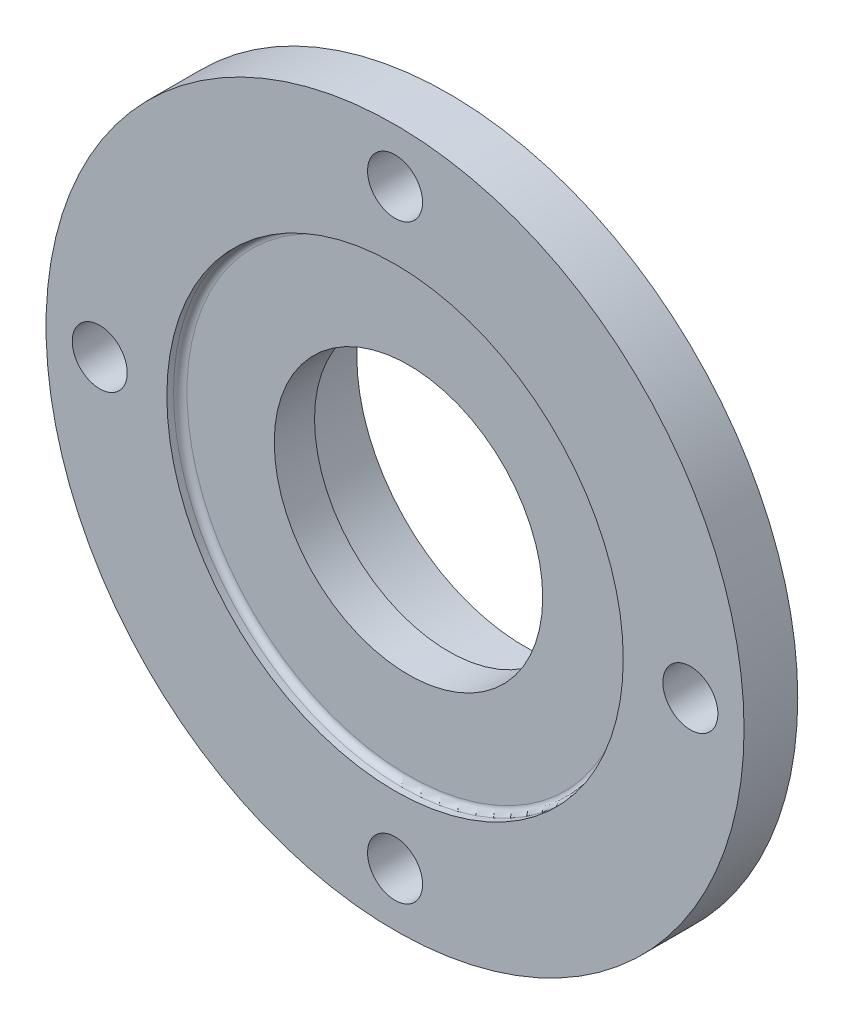
from build123d import *

# Parameters (mm, degrees)
SKETCH_1_R          = 52
SKETCH_1_R_2        = 4.1
EXTRUDE_1_DEPTH     = 8
SKETCH_2_R          = 34
CUT_EXTRUDE_1_DEPTH = 2
FILLET_1_R          = 1
SKETCH_3_R          = 34
SKETCH_3_R_2        = 25
EXTRUDE_2_DEPTH     = 11.3
CHAMFER_1_SIZE      = 0.4
SKETCH_4_R          = 20
CUT_EXTRUDE_2_DEPTH = 10


with BuildPart() as part:
    # Эскиз1 → Бобышка-Вытянуть1 (new body)
    with BuildSketch(Plane.XY):
        Circle(SKETCH_1_R)
        with Locations((0, 44)):
            Circle(SKETCH_1_R_2, mode=Mode.SUBTRACT)
        with Locations((44, 0)):
            Circle(SKETCH_1_R_2, mode=Mode.SUBTRACT)
        with Locations((0, -44)):
            Circle(SKETCH_1_R_2, mode=Mode.SUBTRACT)
        with Locations((-44, 0)):
            Circle(SKETCH_1_R_2, mode=Mode.SUBTRACT)
    extrude(amount=EXTRUDE_1_DEPTH)

    # Эскиз2 → Вырез-Вытянуть1 (cut)
    with BuildSketch(Plane.XY.offset(8)):
        Circle(SKETCH_2_R)
    extrude(amount=-CUT_EXTRUDE_1_DEPTH, mode=Mode.SUBTRACT)

    # Скругление1
    fillet_1_edges = [part.edges().sort_by_distance(p)[0] for p in [
        (-34, 0, 6),
    ]]
    fillet(fillet_1_edges, radius=FILLET_1_R)

    # Эскиз3 → Бобышка-Вытянуть2 (add)
    with BuildSketch(Plane(origin=(0, 0, 0), x_dir=(-1, 0, 0), z_dir=(0, 0, -1))):
        with Locations(Location((0, 0, 0), (0, 0, 180))):
            Circle(SKETCH_3_R)
        Circle(SKETCH_3_R_2, mode=Mode.SUBTRACT)
    extrude(amount=EXTRUDE_2_DEPTH)

    # Фаска1
    chamfer_1_edges = [part.edges().sort_by_distance(p)[0] for p in [
        (25, 0, 0),
    ]]
    chamfer(chamfer_1_edges, length=CHAMFER_1_SIZE)

    # Эскиз4 → Вырез-Вытянуть2 (cut)
    with BuildSketch(Plane(origin=(0, 0, 0), x_dir=(-1, 0, 0), z_dir=(0, 0, -1))):
        Circle(SKETCH_4_R)
    extrude(amount=-CUT_EXTRUDE_2_DEPTH, mode=Mode.SUBTRACT)


solid = part.part
